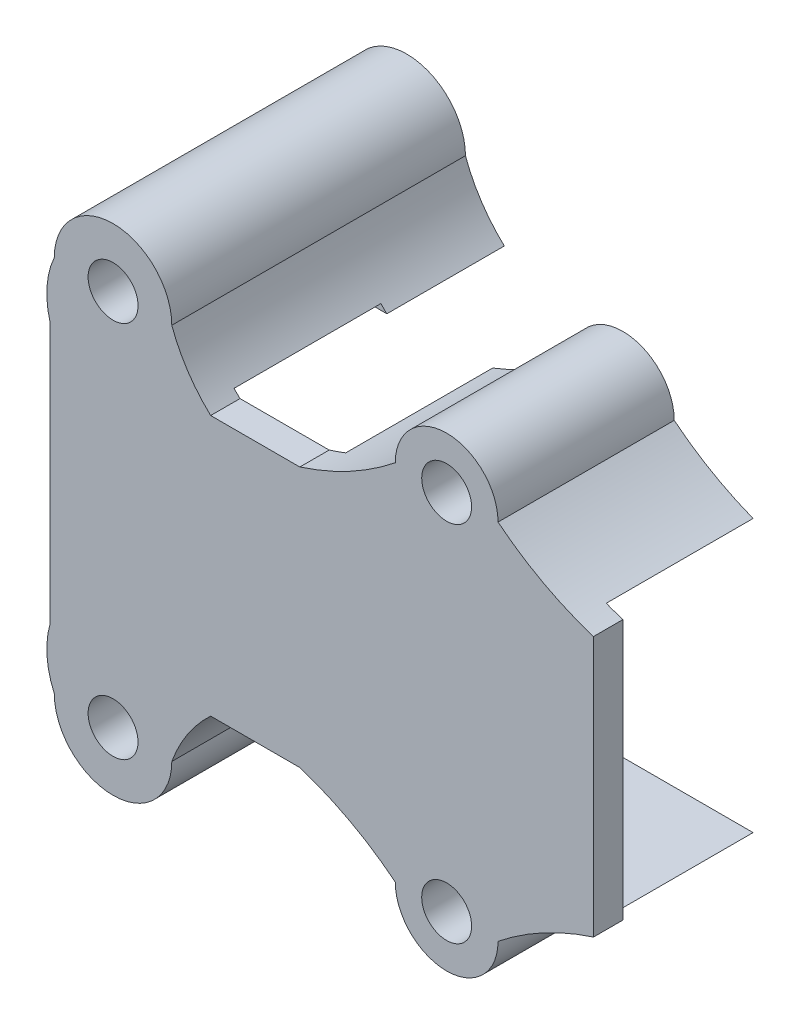
from build123d import *
from build123d.topology import SkipClean

# Parameters (mm, degrees)
CROQUIS1_R              = 1.7
SALIENTE_EXTRUIR1_DEPTH = 2
SALIENTE_EXTRUIR2_START = 10
CROQUIS2_R              = 1.7
SALIENTE_EXTRUIR2_DEPTH = 10
SALIENTE_EXTRUIR3_START = 8
CROQUIS3_R              = 1.7
SALIENTE_EXTRUIR3_DEPTH = 8
CROQUIS4_W              = 37.50862419
CROQUIS4_H              = 18.52759439
CORTAR_EXTRUIR1_DEPTH   = 10


with BuildPart() as part:
    # Croquis1 → Saliente-Extruir1 (new body)
    with BuildSketch(Plane.XY):
        with BuildLine():
            Line((77.885724234, 8.613797195), (71.814275766, 8.613797195))
            ThreePointArc((71.814275766, 8.613797195), (70.251539785, 10.455729214), (69.166367035, 12.613797195))
            ThreePointArc((69.166367035, 12.613797195), (65.166367035, 16.613797195), (61.166367035, 12.613797195))
            ThreePointArc((61.166367035, 12.613797195), (60.667946699, 10.638921667), (60.885724234, 8.613797195))
            Line((60.885724234, 8.613797195), (60.885724234, -9.113797195))
            ThreePointArc((60.885724234, -9.113797195), (60.667946699, -11.138921667), (61.166367035, -13.113797195))
            ThreePointArc((61.166367035, -13.113797195), (65.166367035, -17.113797195), (69.166367035, -13.113797195))
            ThreePointArc((69.166367035, -13.113797195), (70.251539785, -10.955729214), (71.814275766, -9.113797195))
            Line((71.814275766, -9.113797195), (77.885724234, -9.113797195))
            ThreePointArc((77.885724234, -9.113797195), (81.296227313, -10.565720048), (84.385724234, -12.613797195))
            ThreePointArc((84.385724234, -12.613797195), (87.885724234, -16.113797195), (91.385724234, -12.613797195))
            ThreePointArc((91.385724234, -12.613797195), (94.475221154, -10.565720048), (97.885724234, -9.113797195))
            Line((97.885724234, -9.113797195), (97.885724234, 8.613797195))
            ThreePointArc((97.885724234, 8.613797195), (94.475221154, 10.065720048), (91.385724234, 12.113797195))
            ThreePointArc((91.385724234, 12.113797195), (87.885724234, 15.613797195), (84.385724234, 12.113797195))
            ThreePointArc((84.385724234, 12.113797195), (81.296227313, 10.065720048), (77.885724234, 8.613797195))
        make_face()
        with Locations((65.166367035, -13.113797195)):
            Circle(CROQUIS1_R, mode=Mode.SUBTRACT)
        with Locations((65.166367035, 12.613797195)):
            Circle(CROQUIS1_R, mode=Mode.SUBTRACT)
        with Locations((87.885724234, 12.113797195)):
            Circle(CROQUIS1_R, mode=Mode.SUBTRACT)
        with Locations((87.885724234, -12.613797195)):
            Circle(CROQUIS1_R, mode=Mode.SUBTRACT)
    extrude(amount=SALIENTE_EXTRUIR1_DEPTH)

    # Croquis2 → Saliente-Extruir2 (add)
    # profile 1 of 4: a face of its own
    with SkipClean():  # the faces are left unmerged after this step: merging them gives an invalid solid
        with BuildSketch(Plane(origin=(0, 0, 0), x_dir=(-1, 0, 0), z_dir=(0, 0, -1)).offset(SALIENTE_EXTRUIR2_START)):
            with BuildLine():
                Line((-97.885724234, -9.113797195), (-77.885724234, -9.113797195))
                ThreePointArc((-77.885724234, -9.113797195), (-81.296227313, -10.565720048), (-84.385724234, -12.613797195))
                ThreePointArc((-84.385724234, -12.613797195), (-87.885724234, -16.113797195), (-91.385724234, -12.613797195))
                ThreePointArc((-91.385724234, -12.613797195), (-94.475221154, -10.565720048), (-97.885724234, -9.113797195))
            make_face()
            with Locations((-87.885724234, -12.613797195)):
                Circle(CROQUIS2_R, mode=Mode.SUBTRACT)
        # profile 2 of 4: a face of its own
        with BuildSketch(Plane(origin=(0, 0, 0), x_dir=(-1, 0, 0), z_dir=(0, 0, -1)).offset(SALIENTE_EXTRUIR2_START)):
            with BuildLine():
                Line((-97.885724234, 8.613797195), (-77.885724234, 8.613797195))
                ThreePointArc((-77.885724234, 8.613797195), (-81.296227313, 10.065720048), (-84.385724234, 12.113797195))
                ThreePointArc((-84.385724234, 12.113797195), (-87.885724234, 15.613797195), (-91.385724234, 12.113797195))
                ThreePointArc((-91.385724234, 12.113797195), (-94.475221154, 10.065720048), (-97.885724234, 8.613797195))
            make_face()
            with Locations((-87.885724234, 12.113797195)):
                Circle(CROQUIS2_R, mode=Mode.SUBTRACT)
        # profile 3 of 4: a face of its own
        with BuildSketch(Plane(origin=(0, 0, 0), x_dir=(-1, 0, 0), z_dir=(0, 0, -1)).offset(SALIENTE_EXTRUIR2_START)):
            with BuildLine():
                Line((-71.814275766, 8.613797195), (-60.885724234, 8.613797195))
                ThreePointArc((-60.885724234, 8.613797195), (-60.667946699, 10.638921667), (-61.166367035, 12.613797195))
                ThreePointArc((-61.166367035, 12.613797195), (-65.166367035, 16.613797195), (-69.166367035, 12.613797195))
                ThreePointArc((-69.166367035, 12.613797195), (-70.251539785, 10.455729214), (-71.814275766, 8.613797195))
            make_face()
            with Locations((-65.166367035, 12.613797195)):
                Circle(CROQUIS2_R, mode=Mode.SUBTRACT)
        # profile 4 of 4: a face of its own
        with BuildSketch(Plane(origin=(0, 0, 0), x_dir=(-1, 0, 0), z_dir=(0, 0, -1)).offset(SALIENTE_EXTRUIR2_START)):
            with BuildLine():
                Line((-71.814275766, -9.113797195), (-60.885724234, -9.113797195))
                ThreePointArc((-60.885724234, -9.113797195), (-60.667946699, -11.138921667), (-61.166367035, -13.113797195))
                ThreePointArc((-61.166367035, -13.113797195), (-65.166367035, -17.113797195), (-69.166367035, -13.113797195))
                ThreePointArc((-69.166367035, -13.113797195), (-70.251539785, -10.955729214), (-71.814275766, -9.113797195))
            make_face()
            with Locations((-65.166367035, -13.113797195)):
                Circle(CROQUIS2_R, mode=Mode.SUBTRACT)
        extrude(amount=-SALIENTE_EXTRUIR2_DEPTH)

    # Croquis3 → Saliente-Extruir3 (add)
    # profile 1 of 2: a face of its own
    with SkipClean():  # the faces are left unmerged after this step: merging them gives an invalid solid
        with BuildSketch(Plane(origin=(0, 0, -10), x_dir=(-1, 0, 0), z_dir=(0, 0, -1)).offset(SALIENTE_EXTRUIR3_START)):
            with BuildLine():
                Line((-71.814275766, 8.613797195), (-60.885724234, 8.613797195))
                ThreePointArc((-60.885724234, 8.613797195), (-60.667946699, 10.638921667), (-61.166367035, 12.613797195))
                ThreePointArc((-61.166367035, 12.613797195), (-65.166367035, 16.613797195), (-69.166367035, 12.613797195))
                ThreePointArc((-69.166367035, 12.613797195), (-70.251539785, 10.455729214), (-71.814275766, 8.613797195))
            make_face()
            with Locations((-65.166367035, 12.613797195)):
                Circle(CROQUIS3_R, mode=Mode.SUBTRACT)
        # profile 2 of 2: a face of its own
        with BuildSketch(Plane(origin=(0, 0, -10), x_dir=(-1, 0, 0), z_dir=(0, 0, -1)).offset(SALIENTE_EXTRUIR3_START)):
            with BuildLine():
                Line((-60.885724234, -9.113797195), (-71.814275766, -9.113797195))
                ThreePointArc((-71.814275766, -9.113797195), (-70.251539785, -10.955729214), (-69.166367035, -13.113797195))
                ThreePointArc((-69.166367035, -13.113797195), (-65.166367035, -17.113797195), (-61.166367035, -13.113797195))
                ThreePointArc((-61.166367035, -13.113797195), (-60.667946699, -11.138921667), (-60.885724234, -9.113797195))
            make_face()
            with Locations((-65.166367035, -13.113797195)):
                Circle(CROQUIS3_R, mode=Mode.SUBTRACT)
        extrude(amount=-SALIENTE_EXTRUIR3_DEPTH)

    # Croquis4 → Cortar-Extruir1 (cut)
    with SkipClean():  # the faces are left unmerged after this step: merging them gives an invalid solid
        with BuildSketch(Plane(origin=(0, 0, -10), x_dir=(-1, 0, 0), z_dir=(0, 0, -1))):
            with Locations((-79.131412139, -0.25)):
                Rectangle(CROQUIS4_W, CROQUIS4_H)
        extrude(amount=-CORTAR_EXTRUIR1_DEPTH, mode=Mode.SUBTRACT)


solid = part.part
